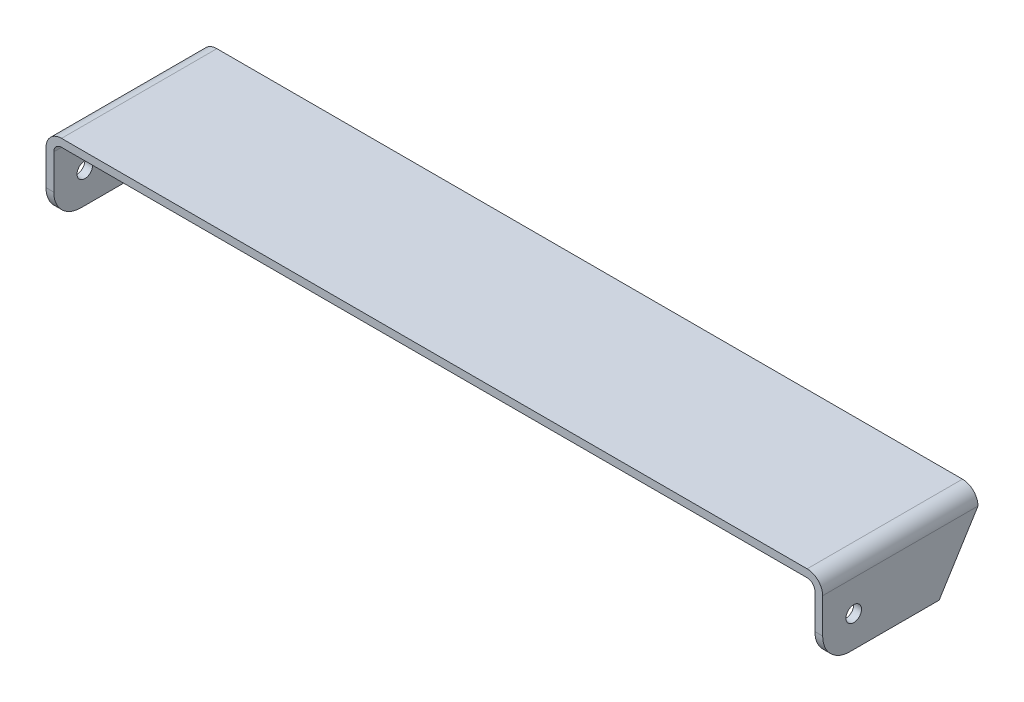
from build123d import *

# Parameters (mm, degrees)
EXTRUDE_THIN1_DEPTH = 100
CUT_EXTRUDE1_DEPTH  = 1218
SKETCH4_R           = 10
CUT_EXTRUDE2_DEPTH  = 1285
FILLET1_R           = 35


with BuildPart() as part:
    # Sketch2 → Extrude-Thin1 (new, symmetric)
    with BuildSketch(Plane.XY):
        with BuildLine():
            Line((-500, 0), (-500, 80))
            ThreePointArc((-500, 80), (-494.142135624, 94.142135624), (-480, 100))
            Line((-480, 100), (480, 100))
            ThreePointArc((480, 100), (494.142135624, 94.142135624), (500, 80))
            Line((500, 80), (500, 0))
            Line((500, 0), (490, 0))
            Line((490, 0), (490, 80))
            ThreePointArc((490, 80), (487.071067812, 87.071067812), (480, 90))
            Line((480, 90), (-480, 90))
            ThreePointArc((-480, 90), (-487.071067812, 87.071067812), (-490, 80))
            Line((-490, 80), (-490, 0))
            Line((-490, 0), (-500, 0))
        make_face()
    extrude(amount=EXTRUDE_THIN1_DEPTH, both=True)

    # Sketch3 → Cut-Extrude1 (cut)
    with BuildSketch(Plane.ZY.offset(500)):
        Polygon((-100, 80), (-100, 0), (-50, 0), align=None)
    extrude(amount=-CUT_EXTRUDE1_DEPTH, mode=Mode.SUBTRACT)

    # Sketch4 → Cut-Extrude2 (cut)
    with BuildSketch(Plane.ZY.offset(500)):
        with Locations((60, 40)):
            Circle(SKETCH4_R)
    extrude(amount=-CUT_EXTRUDE2_DEPTH, mode=Mode.SUBTRACT)

    # Fillet1
    fillet1_edges = [part.edges().sort_by_distance(p)[0] for p in [
        (-495, 0, 100),
        (495, 0, 100),
    ]]
    fillet(fillet1_edges, radius=FILLET1_R)


solid = part.part
